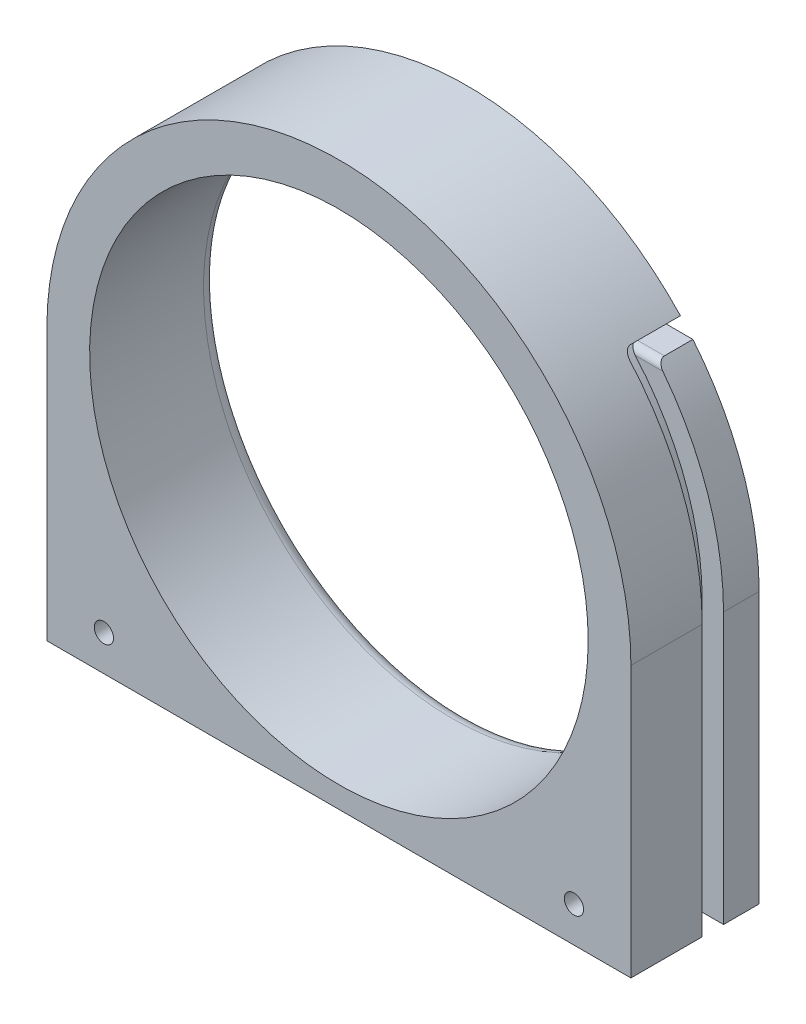
from build123d import *

# Parameters (mm, degrees)
SKETCH_1_R                            = 35.00000000000001
EXTRUDE_21_DEPTH                      = 20
CUT_EXTRUDE_2_DEPTH                   = 4
CUT_EXTRUDE_3_DEPTH                   = 8
CUT_EXTRUDE_4_DEPTH                   = 1
CUT_EXTRUDE_4_DEPTH_BACK              = 2
FILLET_1_R                            = 1
SKETCH_8_W                            = 82
SKETCH_8_H                            = 2
CUT_EXTRUDE_5_DEPTH                   = 92.22499672787059
FILLET_3_R                            = 2
HOLE_WIZARD_2_7_2_7_1_D               = 2.7
HOLE_WIZARD_2_7_2_7_1_DEPTH           = 7
HOLE_WIZARD_2_7_2_7_1_TIP             = 0.8111618356872065
HOLE_WIZARD_2_7_2_7_1_ON_FACE_2_D     = 2.7
HOLE_WIZARD_2_7_2_7_1_ON_FACE_2_DEPTH = 7
HOLE_WIZARD_2_7_2_7_1_ON_FACE_2_TIP   = 0.8111618356872065


with BuildPart() as part:
    # 草图1 → 厚度21 (new body)
    with BuildSketch(Plane.XY):
        with BuildLine():
            Line((-41, 0), (-41, -38.00000000000001))
            Line((-41, -38.00000000000001), (41, -38.00000000000001))
            Line((41, -38.00000000000001), (41, 0))
            ThreePointArc((41, 0), (2.51e-15, 41), (-41, 0))
        make_face()
        Circle(SKETCH_1_R, mode=Mode.SUBTRACT)
    extrude(amount=EXTRUDE_21_DEPTH)

    # 草图5 → 切除-拉伸2 (cut)
    with BuildSketch(Plane(origin=(0, 0, 0), x_dir=(-1, 0, 0), z_dir=(0, 0, -1))):
        with BuildLine():
            Line((-21.000000000000004, 28.00000000000001), (-25.690465157330244, 28.000000000000007))
            ThreePointArc((-25.690465157330244, 28.000000000000007), (-26.720357920143798, 27.01892804349219), (-27.712812921102028, 26.00000000000001))
            Line((-27.712812921102028, 26.00000000000001), (-23.430749027719965, 26.000000000000007))
            ThreePointArc((-23.43074902771997, 26.000000000000007), (-22.237870059676574, 27.02734051306086), (-21.000000000000007, 28.00000000000001))
        make_face()
        with BuildLine():
            Line((25.690465157330244, 28.00000000000001), (20.99999999999999, 28.00000000000001))
            ThreePointArc((20.99999999999999, 28.000000000000014), (22.237870059676567, 27.027340513060857), (23.430749027719965, 26.000000000000007))
            Line((23.430749027719965, 26.000000000000007), (27.712812921102028, 26.00000000000001))
            ThreePointArc((27.712812921102035, 26.000000000000014), (26.720357920143798, 27.018928043492192), (25.69046515733025, 28.000000000000018))
        make_face()
    extrude(amount=-CUT_EXTRUDE_2_DEPTH, mode=Mode.SUBTRACT)

    # 草图6 → 切除-拉伸3 (cut)
    with BuildSketch(Plane(origin=(0, 0, 0), x_dir=(-1, 0, 0), z_dir=(0, 0, -1))):
        with BuildLine():
            ThreePointArc((-27.712812921102028, 26.000000000000004), (-26.72035792014379, 27.01892804349218), (-25.690465157330244, 28.00000000000001))
            Line((-25.690465157330244, 28.000000000000007), (-29.949958263743014, 28.000000000000007))
            ThreePointArc((-29.949958263743238, 28.00000000000068), (-30.842062505518594, 27.014203308735276), (-31.701734968294286, 26.000000000000522))
            Line((-31.70173496829411, 26.000000000000007), (-27.712812921102028, 26.000000000000004))
        make_face()
        with BuildLine():
            ThreePointArc((31.70173496829428, 26.00000000000053), (30.842062505518587, 27.01420330873528), (29.949958263743248, 28.000000000000668))
            Line((29.94995826374302, 28.000000000000007), (25.690465157330244, 28.000000000000007))
            ThreePointArc((25.690465157330244, 28.000000000000007), (26.720357920143798, 27.01892804349219), (27.712812921102028, 26.000000000000007))
            Line((27.712812921102028, 26.000000000000004), (31.701734968294097, 26.000000000000007))
        make_face()
        with BuildLine():
            Line((37.167004412093284, 28.000000000000007), (29.94995826374302, 28.000000000000007))
            ThreePointArc((29.949958263743248, 28.000000000000668), (30.842062505518587, 27.01420330873528), (31.70173496829428, 26.00000000000053))
            Line((31.701734968294097, 26.000000000000007), (37.167004412093284, 26.00000000000001))
            Line((37.167004412093284, 26.00000000000001), (37.167004412093284, 28.000000000000007))
        make_face()
        with BuildLine():
            ThreePointArc((-31.701734968294286, 26.000000000000522), (-30.842062505518594, 27.014203308735276), (-29.949958263743238, 28.00000000000068))
            Line((-29.949958263743014, 28.000000000000007), (-37.167004412093284, 28.000000000000007))
            Line((-37.167004412093284, 28.000000000000007), (-37.167004412093284, 26.00000000000001))
            Line((-37.167004412093284, 26.00000000000001), (-31.70173496829411, 26.000000000000007))
        make_face()
    extrude(amount=-CUT_EXTRUDE_3_DEPTH, mode=Mode.SUBTRACT)

    # 草图7 → 切除-拉伸4 (cut, two sides: drawn at the far end of the back side and taken through both)
    with BuildSketch(Plane(origin=(0, 0, 8), x_dir=(-1, 0, 0), z_dir=(0, 0, -1)).offset(-CUT_EXTRUDE_4_DEPTH_BACK)):
        with BuildLine():
            Line((-38, -36.00000000000001), (37.99999999999999, -36.00000000000001))
            Line((37.99999999999999, -36.00000000000001), (37.99999999999999, 0))
            ThreePointArc((37.99999999999999, 0), (34.786762395906784, 15.29317370628887), (25.690465157330244, 28.00000000000001))
            Line((25.690465157330244, 28.00000000000001), (29.949958263743873, 28.000000000000007))
            ThreePointArc((29.949958263743873, 28.000000000000007), (38.13756867455958, 15.050775913329202), (40.999999999999986, 0))
            Line((40.999999999999986, 0), (41, -38.00000000000001))
            Line((41, -38.00000000000001), (-41, -38.00000000000001))
            Line((-41, -38.00000000000001), (-40.999999999999986, 0))
            ThreePointArc((-40.999999999999986, 0), (-38.137568674559596, 15.050775913329224), (-29.949958263743873, 28.000000000000007))
            Line((-29.949958263743873, 28.000000000000007), (-25.69046515733023, 28.00000000000001))
            ThreePointArc((-25.69046515733023, 28.00000000000001), (-34.78676239590678, 15.293173706288876), (-37.99999999999999, 0))
            Line((-37.99999999999999, 0), (-38, -36.00000000000001))
        make_face()
    extrude(amount=CUT_EXTRUDE_4_DEPTH + CUT_EXTRUDE_4_DEPTH_BACK, mode=Mode.SUBTRACT)

    # 圆角1
    fillet_1_edges = [part.edges().sort_by_distance(p)[0] for p in [
        (29.707273944699274, 26.000000000000004, 7),
        (-29.707273944699253, 26.000000000000004, 7),
        (-37.99999999999999, -36.00000000000001, 8.5),
        (38, -36.00000000000001, 8.5),
        (-27.82021171053706, 28.000000000000007, 10),
        (27.820211710537052, 28.000000000000007, 10),
        (26.72035792014379, 27.01892804349218, 4),
        (-26.720357920143798, 27.018928043492195, 4),
    ]]
    fillet(fillet_1_edges, radius=FILLET_1_R)

    # 草图8 → 切除-拉伸5 (cut, through all)
    with BuildSketch(Plane.XZ.offset(38.00000000000001)):
        with Locations((0, 1)):
            Rectangle(SKETCH_8_W, SKETCH_8_H)
    extrude(amount=-CUT_EXTRUDE_5_DEPTH, mode=Mode.SUBTRACT)

    # 圆角3
    fillet_3_edges = [part.edges().sort_by_distance(p)[0] for p in [
        (-14.228910429646426, -31.97714977894527, 2),
        (-6.43e-15, 35.00000000000001, 2),
    ]]
    fillet(fillet_3_edges, radius=FILLET_3_R)

    # Ø2.7 (2.7) 直径孔1
    with Locations(Plane(origin=(-33, -33, 20), x_dir=(1, 0, 0), z_dir=(0, 0, 1))):
        with Locations((0, 0), (66, 0)):
            Hole(HOLE_WIZARD_2_7_2_7_1_D / 2, depth=HOLE_WIZARD_2_7_2_7_1_DEPTH)
            with Locations((0, 0, -(HOLE_WIZARD_2_7_2_7_1_DEPTH + HOLE_WIZARD_2_7_2_7_1_TIP / 2))):  # 118° drill point
                Cone(0, HOLE_WIZARD_2_7_2_7_1_D / 2, HOLE_WIZARD_2_7_2_7_1_TIP, mode=Mode.SUBTRACT)

    # Ø2.7 (2.7) 直径孔1 on face 2
    with Locations(Plane(origin=(26, -38, 15), x_dir=(0, 0, -1), z_dir=(0, -1, 0))):
        with Locations((0, 0), (0, -52)):
            Hole(HOLE_WIZARD_2_7_2_7_1_ON_FACE_2_D / 2, depth=HOLE_WIZARD_2_7_2_7_1_ON_FACE_2_DEPTH)
            with Locations((0, 0, -(HOLE_WIZARD_2_7_2_7_1_ON_FACE_2_DEPTH + HOLE_WIZARD_2_7_2_7_1_ON_FACE_2_TIP / 2))):  # 118° drill point
                Cone(0, HOLE_WIZARD_2_7_2_7_1_ON_FACE_2_D / 2, HOLE_WIZARD_2_7_2_7_1_ON_FACE_2_TIP, mode=Mode.SUBTRACT)


solid = part.part
